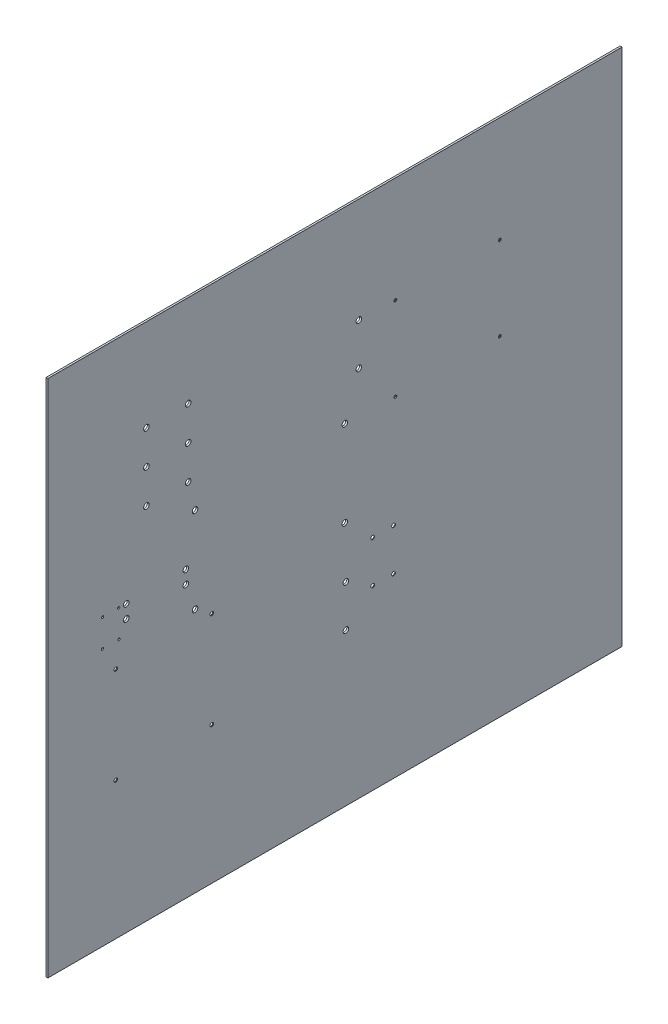
from build123d import *

# Parameters (mm, degrees)
SKETCH1_W                                     = 698.6905
SKETCH1_H                                     = 631.825
BOSS_EXTRUDE1_DEPTH                           = 2.286
SKETCH3_R                                     = 3.3734375
CUT_EXTRUDE1_DEPTH                            = 943.006619516
CSK_FOR_6_FLAT_HEAD_MACHINE_SCREW1_AT_2_COUNT = 2
CSK_FOR_6_FLAT_HEAD_MACHINE_SCREW1_AT_2_PITCH = 117
CSK_FOR_6_FLAT_HEAD_MACHINE_SCREW1_AT_3_COUNT = 2
CSK_FOR_6_FLAT_HEAD_MACHINE_SCREW1_AT_3_PITCH = 165.462986798
CSK_FOR_6_FLAT_HEAD_MACHINE_SCREW1_AT_4_COUNT = 2
CSK_FOR_6_FLAT_HEAD_MACHINE_SCREW1_AT_4_PITCH = 117
CSK_FOR_2_FLAT_HEAD_MACHINE_SCREW1_AT_2_COUNT = 2
CSK_FOR_2_FLAT_HEAD_MACHINE_SCREW1_AT_2_PITCH = 19.55
CSK_FOR_2_FLAT_HEAD_MACHINE_SCREW1_AT_3_COUNT = 2
CSK_FOR_2_FLAT_HEAD_MACHINE_SCREW1_AT_3_PITCH = 38.853346059
CSK_FOR_2_FLAT_HEAD_MACHINE_SCREW1_AT_4_COUNT = 2
CSK_FOR_2_FLAT_HEAD_MACHINE_SCREW1_AT_4_PITCH = 33.401347278
CSK_FOR_4_FLAT_HEAD_MACHINE_SCREW1_AT_2_COUNT = 2
CSK_FOR_4_FLAT_HEAD_MACHINE_SCREW1_AT_2_PITCH = 101.6
CSK_FOR_4_FLAT_HEAD_MACHINE_SCREW1_AT_3_COUNT = 2
CSK_FOR_4_FLAT_HEAD_MACHINE_SCREW1_AT_3_PITCH = 162.639355631
CSK_FOR_4_FLAT_HEAD_MACHINE_SCREW1_AT_4_COUNT = 2
CSK_FOR_4_FLAT_HEAD_MACHINE_SCREW1_AT_4_PITCH = 127
CSK_FOR_8_FLAT_HEAD_MACHINE_SCREW1_AT_2_COUNT = 2
CSK_FOR_8_FLAT_HEAD_MACHINE_SCREW1_AT_2_PITCH = 56.796126628
CSK_FOR_8_FLAT_HEAD_MACHINE_SCREW1_AT_3_COUNT = 2
CSK_FOR_8_FLAT_HEAD_MACHINE_SCREW1_AT_3_PITCH = 50.8
CSK_FOR_8_FLAT_HEAD_MACHINE_SCREW1_AT_4_COUNT = 2
CSK_FOR_8_FLAT_HEAD_MACHINE_SCREW1_AT_4_PITCH = 25.4


with BuildPart() as part:
    # Sketch1 → Boss-Extrude1 (new body)
    with BuildSketch(Plane(origin=(0, 0, 0), x_dir=(0, 0, -1), z_dir=(1, 0, 0))):
        with Locations((349.34525, 315.9125)):
            Rectangle(SKETCH1_W, SKETCH1_H)
    extrude(amount=BOSS_EXTRUDE1_DEPTH)

    # Sketch3 → Cut-Extrude1 (cut, through all)
    with BuildSketch(Plane(origin=(2.286, 0, 0), x_dir=(0, 0, -1), z_dir=(1, 0, 0))):
        with Locations((179.07, 299.08)):
            Circle(SKETCH3_R)
        with Locations((179.07, 403.474)):
            Circle(SKETCH3_R)
        with Locations((361.3404, 403.474)):
            Circle(SKETCH3_R)
        with Locations((361.3404, 299.08)):
            Circle(SKETCH3_R)
        with Locations((119.910999954, 437.406)):
            Circle(SKETCH3_R)
        with Locations((170.710999954, 437.406)):
            Circle(SKETCH3_R)
        with Locations((119.910999954, 478.681)):
            Circle(SKETCH3_R)
        with Locations((170.710999954, 478.681)):
            Circle(SKETCH3_R)
        with Locations((119.910999954, 519.956)):
            Circle(SKETCH3_R)
        with Locations((170.710999954, 519.956)):
            Circle(SKETCH3_R)
        with Locations((362.727, 185.332)):
            Circle(SKETCH3_R)
        with Locations((362.727, 236.132)):
            Circle(SKETCH3_R)
        with Locations((378.46, 453.39)):
            Circle(SKETCH3_R)
        with Locations((378.46, 504.19)):
            Circle(SKETCH3_R)
        with Locations((95.385999982, 330.685)):
            Circle(SKETCH3_R)
        with Locations((95.385999982, 346.685)):
            Circle(SKETCH3_R)
        with Locations((167.885999982, 346.685)):
            Circle(SKETCH3_R)
        with Locations((167.885999982, 330.685)):
            Circle(SKETCH3_R)
    extrude(amount=-CUT_EXTRUDE1_DEPTH, mode=Mode.SUBTRACT)

    # Sketch5 → CSK for #6 Flat Head Machine Screw1 (revolve, cut)
    with BuildSketch(Plane(origin=(0, 167.2844, -82.55), x_dir=(0, 0, 1), z_dir=(0, 1, 0))):
        Polygon((0, 0), (0, 2.286), (2.15265, 2.286), (2.15265, 1.599759826), (3.5433, 0), align=None)
    csk_for_6_flat_head_machine_screw1 = revolve(axis=Axis((-6.35, 167.2844, -82.55), (1, 0, 0)), mode=Mode.SUBTRACT)

    # CSK for #6 Flat Head Machine Screw1 at 2: CSK for #6 Flat Head Machine Screw1 ×2
    with Locations(*[(0, 0, -i * CSK_FOR_6_FLAT_HEAD_MACHINE_SCREW1_AT_2_PITCH) for i in range(1, CSK_FOR_6_FLAT_HEAD_MACHINE_SCREW1_AT_2_COUNT)]):
        add(csk_for_6_flat_head_machine_screw1, mode=Mode.SUBTRACT)

    # CSK for #6 Flat Head Machine Screw1 at 3: CSK for #6 Flat Head Machine Screw1 ×2
    with Locations(*[Vector(0, 0.7071067811865476, -0.7071067811865476) * (i * CSK_FOR_6_FLAT_HEAD_MACHINE_SCREW1_AT_3_PITCH) for i in range(1, CSK_FOR_6_FLAT_HEAD_MACHINE_SCREW1_AT_3_COUNT)]):
        add(csk_for_6_flat_head_machine_screw1, mode=Mode.SUBTRACT)

    # CSK for #6 Flat Head Machine Screw1 at 4: CSK for #6 Flat Head Machine Screw1 ×2
    with Locations(*[(0, i * CSK_FOR_6_FLAT_HEAD_MACHINE_SCREW1_AT_4_PITCH, 0) for i in range(1, CSK_FOR_6_FLAT_HEAD_MACHINE_SCREW1_AT_4_COUNT)]):
        add(csk_for_6_flat_head_machine_screw1, mode=Mode.SUBTRACT)

    # Sketch10 → CSK for #2 Flat Head Machine Screw1 (revolve, cut)
    with BuildSketch(Plane(origin=(0, 347.054, -66.588), x_dir=(0, 0, 1), z_dir=(0, 1, 0))):
        Polygon((0, 0), (0, 2.286), (1.35255, 2.286), (1.35255, 0.95693396), (2.1844, 0), align=None)
    csk_for_2_flat_head_machine_screw1 = revolve(axis=Axis((-6.35, 347.054, -66.588), (1, 0, 0)), mode=Mode.SUBTRACT)

    # CSK for #2 Flat Head Machine Screw1 at 2: CSK for #2 Flat Head Machine Screw1 ×2
    with Locations(*[(0, 0, -i * CSK_FOR_2_FLAT_HEAD_MACHINE_SCREW1_AT_2_PITCH) for i in range(1, CSK_FOR_2_FLAT_HEAD_MACHINE_SCREW1_AT_2_COUNT)]):
        add(csk_for_2_flat_head_machine_screw1, mode=Mode.SUBTRACT)

    # CSK for #2 Flat Head Machine Screw1 at 3: CSK for #2 Flat Head Machine Screw1 ×2
    with Locations(*[Vector(0, -0.8596428206997768, -0.5108955087092969) * (i * CSK_FOR_2_FLAT_HEAD_MACHINE_SCREW1_AT_3_PITCH) for i in range(1, CSK_FOR_2_FLAT_HEAD_MACHINE_SCREW1_AT_3_COUNT)]):
        add(csk_for_2_flat_head_machine_screw1, mode=Mode.SUBTRACT)

    # CSK for #2 Flat Head Machine Screw1 at 4: CSK for #2 Flat Head Machine Screw1 ×2
    with Locations(*[Vector(0, -0.9999596639559187, 0.008981673628349049) * (i * CSK_FOR_2_FLAT_HEAD_MACHINE_SCREW1_AT_4_PITCH) for i in range(1, CSK_FOR_2_FLAT_HEAD_MACHINE_SCREW1_AT_4_COUNT)]):
        add(csk_for_2_flat_head_machine_screw1, mode=Mode.SUBTRACT)

    # Sketch12 → CSK for #4 Flat Head Machine Screw1 (revolve, cut)
    with BuildSketch(Plane(origin=(0, 502.92, -422.91), x_dir=(0, 0, 1), z_dir=(0, 1, 0))):
        Polygon((0, 0), (0, 2.286), (1.7272, 2.286), (1.7272, 1.300261411), (2.8575, 0), align=None)
    csk_for_4_flat_head_machine_screw1 = revolve(axis=Axis((-6.35, 502.92, -422.91), (1, 0, 0)), mode=Mode.SUBTRACT)

    # CSK for #4 Flat Head Machine Screw1 at 2: CSK for #4 Flat Head Machine Screw1 ×2
    with Locations(*[(0, -i * CSK_FOR_4_FLAT_HEAD_MACHINE_SCREW1_AT_2_PITCH, 0) for i in range(1, CSK_FOR_4_FLAT_HEAD_MACHINE_SCREW1_AT_2_COUNT)]):
        add(csk_for_4_flat_head_machine_screw1, mode=Mode.SUBTRACT)

    # CSK for #4 Flat Head Machine Screw1 at 3: CSK for #4 Flat Head Machine Screw1 ×2
    with Locations(*[Vector(0, -0.6246950475544247, -0.7808688094430299) * (i * CSK_FOR_4_FLAT_HEAD_MACHINE_SCREW1_AT_3_PITCH) for i in range(1, CSK_FOR_4_FLAT_HEAD_MACHINE_SCREW1_AT_3_COUNT)]):
        add(csk_for_4_flat_head_machine_screw1, mode=Mode.SUBTRACT)

    # CSK for #4 Flat Head Machine Screw1 at 4: CSK for #4 Flat Head Machine Screw1 ×2
    with Locations(*[(0, 0, -i * CSK_FOR_4_FLAT_HEAD_MACHINE_SCREW1_AT_4_PITCH) for i in range(1, CSK_FOR_4_FLAT_HEAD_MACHINE_SCREW1_AT_4_COUNT)]):
        add(csk_for_4_flat_head_machine_screw1, mode=Mode.SUBTRACT)

    # Sketch14 → CSK for #8 Flat Head Machine Screw1 (revolve, cut)
    with BuildSketch(Plane(origin=(0, 215.9, -395.2875), x_dir=(0, 0, 1), z_dir=(0, 1, 0))):
        Polygon((0, 0), (0, 2.286), (2.2479, 2.286), (2.2479, 2.26450021), (4.2164, 0), align=None)
    csk_for_8_flat_head_machine_screw1 = revolve(axis=Axis((-6.35, 215.9, -395.2875), (1, 0, 0)), mode=Mode.SUBTRACT)

    # CSK for #8 Flat Head Machine Screw1 at 2: CSK for #8 Flat Head Machine Screw1 ×2
    with Locations(*[Vector(0, 0.8944271909999156, -0.44721359549995837) * (i * CSK_FOR_8_FLAT_HEAD_MACHINE_SCREW1_AT_2_PITCH) for i in range(1, CSK_FOR_8_FLAT_HEAD_MACHINE_SCREW1_AT_2_COUNT)]):
        add(csk_for_8_flat_head_machine_screw1, mode=Mode.SUBTRACT)

    # CSK for #8 Flat Head Machine Screw1 at 3: CSK for #8 Flat Head Machine Screw1 ×2
    with Locations(*[(0, i * CSK_FOR_8_FLAT_HEAD_MACHINE_SCREW1_AT_3_PITCH, 0) for i in range(1, CSK_FOR_8_FLAT_HEAD_MACHINE_SCREW1_AT_3_COUNT)]):
        add(csk_for_8_flat_head_machine_screw1, mode=Mode.SUBTRACT)

    # CSK for #8 Flat Head Machine Screw1 at 4: CSK for #8 Flat Head Machine Screw1 ×2
    with Locations(*[(0, 0, -i * CSK_FOR_8_FLAT_HEAD_MACHINE_SCREW1_AT_4_PITCH) for i in range(1, CSK_FOR_8_FLAT_HEAD_MACHINE_SCREW1_AT_4_COUNT)]):
        add(csk_for_8_flat_head_machine_screw1, mode=Mode.SUBTRACT)


solid = part.part
